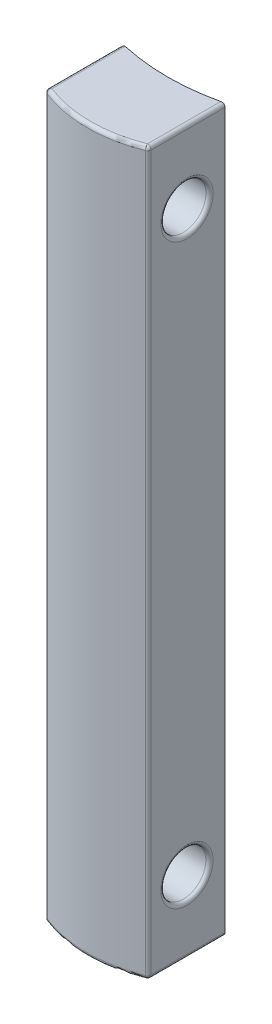
from build123d import *

# Parameters (mm, degrees)
BOSS_EXTRUDE1_DEPTH = 254
SKETCH2_R           = 7.9375
CUT_EXTRUDE1_DEPTH  = 261.833544861
FILLET1_R           = 1.27


with BuildPart() as part:
    # Sketch1 → Boss-Extrude1 (new body)
    with BuildSketch(Plane(origin=(0, 0, 0), x_dir=(1, 0, 0), z_dir=(0, 1, 0))):
        with BuildLine():
            Line((-18.0975, -16.448172274), (-18.0975, -43.365200262))
            ThreePointArc((-18.0975, -43.365200262), (0, -46.99), (18.0975, -43.365200262))
            Line((18.0975, -43.365200262), (18.0975, -16.448172274))
            ThreePointArc((18.0975, -16.448172274), (0, -18.628441839), (-18.0975, -16.448172274))
        make_face()
    extrude(amount=BOSS_EXTRUDE1_DEPTH)

    # Sketch2 → Cut-Extrude1 (cut, through all)
    with BuildSketch(Plane(origin=(18.0975, 0, 0), x_dir=(0, 0, -1), z_dir=(1, 0, 0))):
        with Locations((-29.906686268, 228.6)):
            Circle(SKETCH2_R)
        with Locations((-29.906686268, 25.4)):
            Circle(SKETCH2_R)
    extrude(amount=-CUT_EXTRUDE1_DEPTH, mode=Mode.SUBTRACT)

    # Fillet1
    fillet1_edges = [part.edges().sort_by_distance(p)[0] for p in [
        (0, 254, 46.99),
        (18.0975, 254, 29.906686268),
        (-18.0975, 228.6, 37.844186268),
        (18.0975, 228.6, 37.844186268),
        (-18.0975, 25.4, 37.844186268),
        (18.0975, 25.4, 37.844186268),
        (18.0975, 0, 29.906686268),
        (0, 0, 46.99),
        (-18.0975, 0, 29.906686268),
        (18.0975, 127, 43.365200262),
        (-18.0975, 127, 43.365200262),
        (-18.0975, 127, 16.448172274),
        (-18.0975, 254, 29.906686268),
    ]]
    fillet(fillet1_edges, radius=FILLET1_R)


solid = part.part
